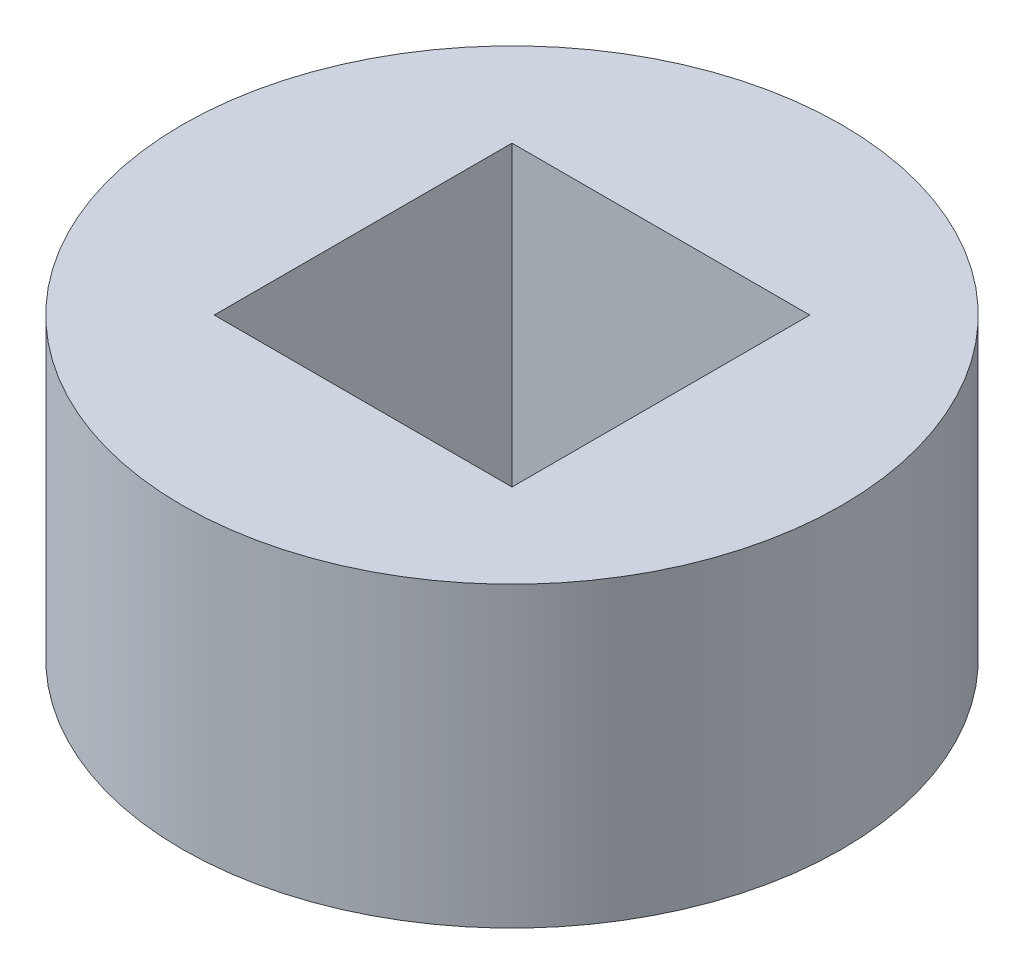
from build123d import *

# Parameters (mm, degrees)
ELEVATOR_AXLE_BEARING_R = 7.030128061
ELEVATOR_AXLE_BEARING_W = 6.35
ELEVATOR_AXLE_BEARING_H = 6.35
BOSS_EXTRUDE1_DEPTH     = 6.35


with BuildPart() as part:
    # Elevator Axle Bearing → Boss-Extrude1 (new body)
    with BuildSketch(Plane(origin=(0, 0, 0), x_dir=(1, 0, 0), z_dir=(0, 1, 0))):
        with Locations(Location((0, 0, 0), (0, 0, 270))):
            Circle(ELEVATOR_AXLE_BEARING_R)
        Rectangle(ELEVATOR_AXLE_BEARING_W, ELEVATOR_AXLE_BEARING_H, mode=Mode.SUBTRACT)
    extrude(amount=BOSS_EXTRUDE1_DEPTH)


solid = part.part
